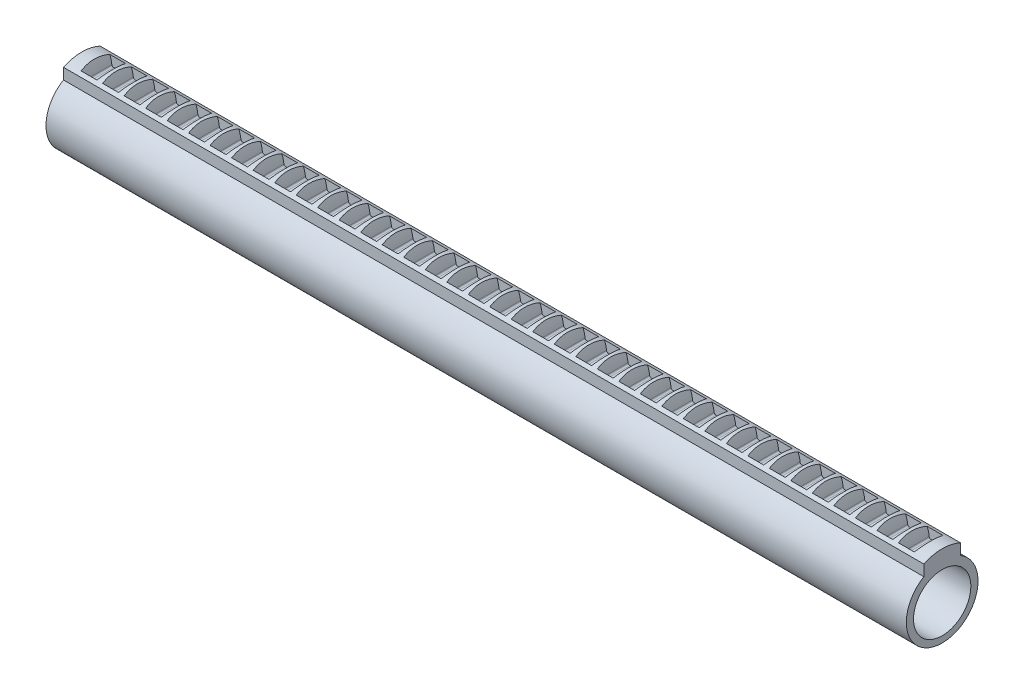
from build123d import *

# Parameters (mm, degrees)
SKETCH1_R           = 5
BOSS_EXTRUDE1_DEPTH = 75
CUT_EXTRUDE1_START  = -0.7
CUT_EXTRUDE1_DEPTH  = 5
LPATTERN1_COUNT     = 20
LPATTERN1_PITCH     = 3.75
LPATTERN1_COL_COUNT = 20
LPATTERN1_COL_PITCH = 3.75


with BuildPart() as part:
    # Sketch1 → Boss-Extrude1 (new, symmetric)
    # profile 1 of 4: a face of its own
    with BuildSketch(Plane(origin=(0, 0, 0), x_dir=(0, 0, -1), z_dir=(1, 0, 0))):
        with BuildLine():
            Line((-3.2, 4.86865905), (-3.2, 4.654829659))
            Line((-3.2, 4.654829659), (3.2, 4.654829659))
            Line((3.2, 4.654829659), (3.2, 4.86865905))
            ThreePointArc((3.2, 4.86865905), (0, 5.75), (-3.2, 4.86865905))
        make_face()
    # profile 2 of 4: a face of its own
    with BuildSketch(Plane(origin=(0, 0, 0), x_dir=(0, 0, -1), z_dir=(1, 0, 0))):
        with BuildLine():
            Line((3.2, 4.654829659), (-3.2, 4.654829659))
            Line((-3.2, 4.654829659), (-3.2, 4.86865905))
            ThreePointArc((-3.2, 4.86865905), (-3.087272259, -5.93426628), (6.25, -0.5))
            ThreePointArc((6.25, -0.5), (5.43426628, 2.587272259), (3.2, 4.86865905))
            Line((3.2, 4.86865905), (3.2, 4.654829659))
        make_face()
        with Locations((0, -0.65)):
            Circle(SKETCH1_R, mode=Mode.SUBTRACT)
    # profile 3 of 4: a face of its own
    with BuildSketch(Plane(origin=(0, 0, 0), x_dir=(0, 0, -1), z_dir=(1, 0, 0))):
        with BuildLine():
            Line((-3.2, 6.783067153), (-3.2, 4.86865905))
            ThreePointArc((-3.2, 4.86865905), (0, 5.75), (3.2, 4.86865905))
            Line((3.2, 4.86865905), (3.2, 6.783067153))
            Line((3.2, 6.783067153), (-3.2, 6.783067153))
        make_face()
    # profile 4 of 4: a face of its own
    with BuildSketch(Plane(origin=(0, 0, 0), x_dir=(0, 0, -1), z_dir=(1, 0, 0))):
        with BuildLine():
            ThreePointArc((3.2, 6.783067153), (0, 7.5), (-3.2, 6.783067153))
            Line((-3.2, 6.783067153), (3.2, 6.783067153))
        make_face()
    extrude(amount=BOSS_EXTRUDE1_DEPTH, both=True)

    # Sketch2 → Cut-Extrude1 (cut)
    with BuildSketch(Plane.XY.offset(3.2).offset(CUT_EXTRUDE1_START)):
        with BuildLine():
            Line((-1.266168605, 6.783067153), (0, 6.783067153))
            Line((0, 6.783067153), (0, 8.693067153))
            Line((0, 8.693067153), (-2.58, 8.693067153))
            ThreePointArc((-2.58, 8.693067153), (-1.799680269, 7.822953065), (-1.266168605, 6.783067153))
        make_face()
        with BuildLine():
            Line((0, 8.693067153), (0, 6.783067153))
            Line((0, 6.783067153), (1.266168605, 6.783067153))
            ThreePointArc((1.266168605, 6.783067153), (1.799680269, 7.822953065), (2.58, 8.693067153))
            Line((2.58, 8.693067153), (0, 8.693067153))
        make_face()
        with BuildLine():
            Line((-0.719874756, 5.413067153), (0, 5.413067153))
            Line((0, 5.413067153), (0, 6.783067153))
            Line((0, 6.783067153), (-1.266168605, 6.783067153))
            ThreePointArc((-1.266168605, 6.783067153), (-1.10821815, 6.241105896), (-1.018441911, 5.683781415))
            ThreePointArc((-1.018441911, 5.683781415), (-0.921386888, 5.490822106), (-0.719874756, 5.413067153))
        make_face()
        with BuildLine():
            Line((0, 6.783067153), (0, 5.413067153))
            Line((0, 5.413067153), (0.719874756, 5.413067153))
            ThreePointArc((0.719874756, 5.413067153), (0.921386888, 5.490822106), (1.018441911, 5.683781415))
            ThreePointArc((1.018441911, 5.683781415), (1.10821815, 6.241105896), (1.266168605, 6.783067153))
            Line((1.266168605, 6.783067153), (0, 6.783067153))
        make_face()
    cut_extrude1 = extrude(amount=-CUT_EXTRUDE1_DEPTH, mode=Mode.SUBTRACT)

    # LPattern1: Cut-Extrude1 ×20
    with Locations(*[(-i * LPATTERN1_PITCH, 0, 0) for i in range(1, LPATTERN1_COUNT)]):
        add(cut_extrude1, mode=Mode.SUBTRACT)

    # LPattern1 col: Cut-Extrude1 ×20
    with Locations(*[(i * LPATTERN1_COL_PITCH, 0, 0) for i in range(1, LPATTERN1_COL_COUNT)]):
        add(cut_extrude1, mode=Mode.SUBTRACT)


solid = part.part
